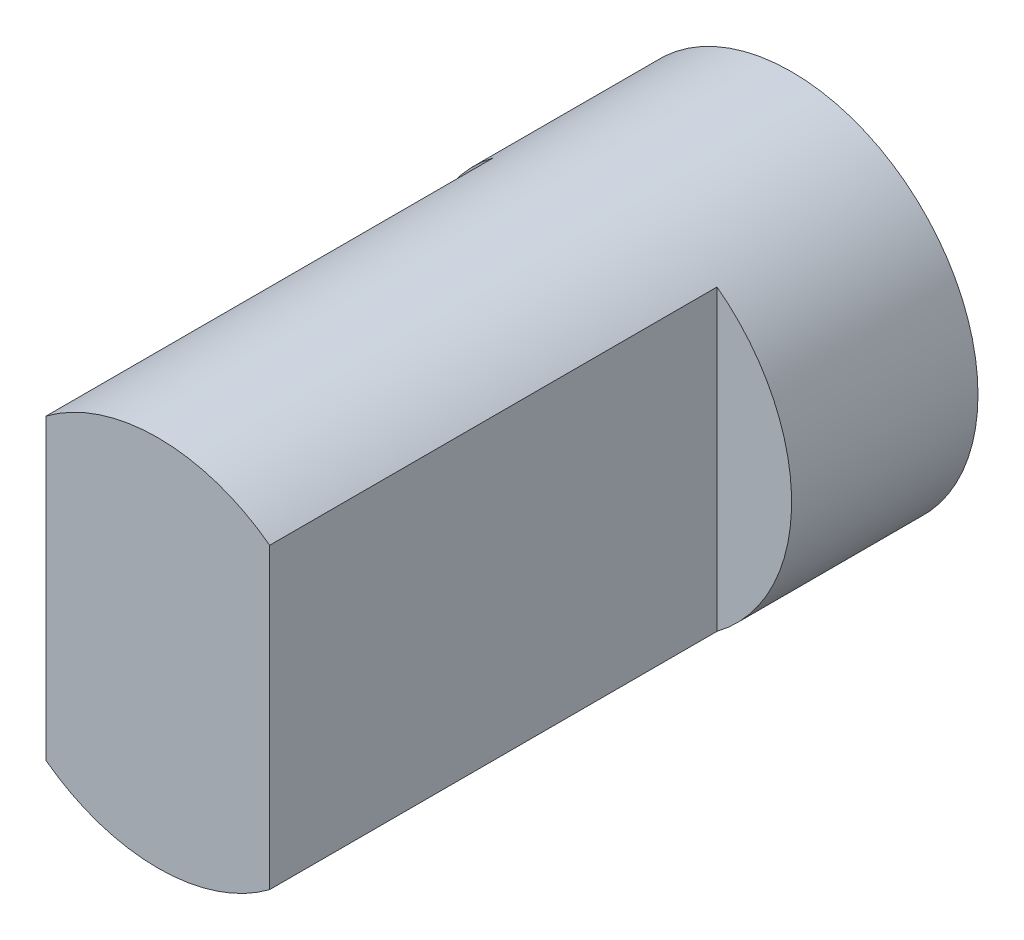
from build123d import *

# Parameters (mm, degrees)
SKETCH1_R           = 2.5
BOSS_EXTRUDE1_DEPTH = 8.5
CUT_EXTRUDE1_START  = -6
CUT_EXTRUDE1_DEPTH  = 6


with BuildPart() as part:
    # Sketch1 → Boss-Extrude1 (new body)
    with BuildSketch(Plane.XY):
        Circle(SKETCH1_R)
    extrude(amount=BOSS_EXTRUDE1_DEPTH)

    # Sketch2 → Cut-Extrude1 (cut)
    with BuildSketch(Plane.XY.offset(8.5).offset(CUT_EXTRUDE1_START)):
        with BuildLine():
            Line((-1.5, 2), (-1.5, -2))
            ThreePointArc((-1.5, -2), (-2.5, 0), (-1.5, 2))
        make_face()
        with BuildLine():
            Line((1.5, 2), (1.5, -2))
            ThreePointArc((1.5, -2), (2.5, 0), (1.5, 2))
        make_face()
    extrude(amount=CUT_EXTRUDE1_DEPTH, mode=Mode.SUBTRACT)


solid = part.part
